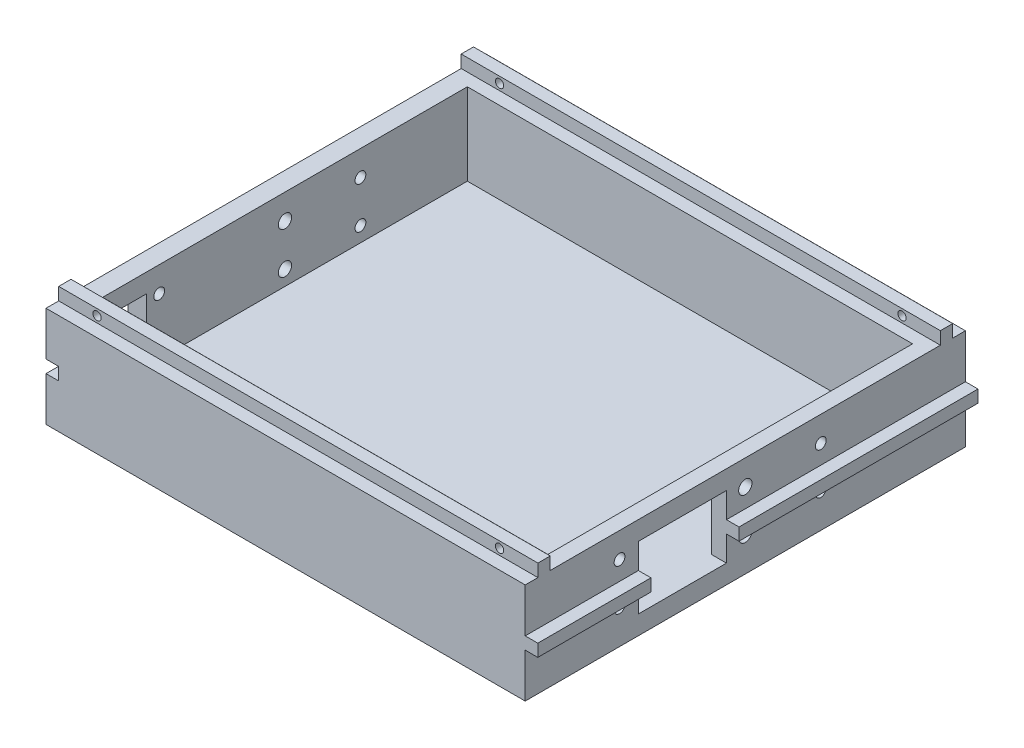
from build123d import *

# Parameters (mm, degrees)
SKETCH1_W           = 190.5
SKETCH1_H           = 175
BOSS_EXTRUDE1_DEPTH = 40
SHELL1_T            = -15
SKETCH2_W           = 175
SKETCH2_H           = 4.9
BOSS_EXTRUDE2_DEPTH = 5
SKETCH3_W           = 5
SKETCH3_H           = 5
CUT_EXTRUDE1_DEPTH  = 175
SKETCH4_W           = 7.5
SKETCH4_H           = 145
CUT_EXTRUDE2_DEPTH  = 25
CUT_EXTRUDE3_START  = -190.5
SKETCH5_R           = 2.65
SKETCH5_R_2         = 2.15
CUT_EXTRUDE3_DEPTH  = 190.5
SKETCH6_W           = 168
SKETCH6_H           = 145
CUT_EXTRUDE4_DEPTH  = 7.5
CUT_EXTRUDE5_REACH  = 140.947
SKETCH7_W           = 9
SKETCH7_H           = 144.996152815
BOSS_EXTRUDE3_START = -7.5
SKETCH9_W           = 190.5
SKETCH9_H           = 5
BOSS_EXTRUDE3_DEPTH = 2.45
SKETCH11_R          = 1.65
CUT_EXTRUDE7_DEPTH  = 4.9
SKETCH12_W          = 35
SKETCH12_H          = 25
CUT_EXTRUDE8_DEPTH  = 213.19154083
CUT_EXTRUDE9_REACH  = 214.192
SKETCH13_W          = 15
SKETCH13_H          = 25


with BuildPart() as part:
    # Sketch1 → Boss-Extrude1 (new body)
    with BuildSketch(Plane(origin=(0, 0, 0), x_dir=(1, 0, 0), z_dir=(0, 1, 0))):
        Rectangle(SKETCH1_W, SKETCH1_H)
    extrude(amount=BOSS_EXTRUDE1_DEPTH)

    # Shell1
    shell1_openings = [part.faces().sort_by_distance(p)[0] for p in [
        (0, 40, 0),
    ]]
    offset(amount=SHELL1_T, openings=shell1_openings, kind=Kind.INTERSECTION)

    # Sketch2 → Boss-Extrude2 (add)
    with BuildSketch(Plane(origin=(95.25, 0, 0), x_dir=(0, 0, -1), z_dir=(1, 0, 0))):
        with Locations((0, 20)):
            Rectangle(SKETCH2_W, SKETCH2_H)
    extrude(amount=BOSS_EXTRUDE2_DEPTH)

    # Sketch3 → Cut-Extrude1 (cut)
    with BuildSketch(Plane.XY.offset(87.5)):
        with Locations((-92.75, 20)):
            Rectangle(SKETCH3_W, SKETCH3_H)
    extrude(amount=-CUT_EXTRUDE1_DEPTH, mode=Mode.SUBTRACT)

    # Sketch4 → Cut-Extrude2 (cut)
    with BuildSketch(Plane(origin=(0, 40, 0), x_dir=(1, 0, 0), z_dir=(0, 1, 0))):
        with Locations((-84, 0)):
            Rectangle(SKETCH4_W, SKETCH4_H)
    extrude(amount=-CUT_EXTRUDE2_DEPTH, mode=Mode.SUBTRACT)

    # Sketch5 → Cut-Extrude3 (cut)
    with BuildSketch(Plane.ZY.offset(95.25).offset(CUT_EXTRUDE3_START)):
        with Locations((0, 30)):
            Circle(SKETCH5_R)
        with Locations((-30, 30)):
            Circle(SKETCH5_R_2)
        with Locations((50, 30)):
            Circle(SKETCH5_R_2)
        with Locations((-30, 13.5)):
            Circle(SKETCH5_R_2)
        with Locations((0, 13.5)):
            Circle(SKETCH5_R)
        with Locations((50, 13.5)):
            Circle(SKETCH5_R_2)
    cut_extrude3 = extrude(amount=CUT_EXTRUDE3_DEPTH, mode=Mode.SUBTRACT)

    # Sketch6 → Cut-Extrude4 (cut)
    with BuildSketch(Plane(origin=(0, 15, 0), x_dir=(1, 0, 0), z_dir=(0, 1, 0))):
        with Locations((-3.75, 0)):
            Rectangle(SKETCH6_W, SKETCH6_H)
    extrude(amount=-CUT_EXTRUDE4_DEPTH, mode=Mode.SUBTRACT)

    # Mirror1: Cut-Extrude3 across plane
    add(cut_extrude3.mirror(Plane(origin=(0, 0, 0), x_dir=(0, 0, 1), z_dir=(1, 0, 0))), mode=Mode.SUBTRACT)

    # Cut-Extrude5: up to this face of the body (flat: up to its plane)
    cut_extrude5_end = Plane(part.part.faces().sort_by_distance((-3.75, 7.5, 0))[0])
    # Sketch7 → Cut-Extrude5 (cut, up to the picked face)
    with BuildSketch(Plane(origin=(0, 40, 0), x_dir=(1, 0, 0), z_dir=(0, 1, 0)), mode=Mode.PRIVATE) as cut_extrude5_sk1:
        with Locations((84.75, 0.001923592)):
            Rectangle(SKETCH7_W, SKETCH7_H)
    cut_extrude5_tool1 = split(extrude(cut_extrude5_sk1.sketch, amount=-CUT_EXTRUDE5_REACH, mode=Mode.PRIVATE), bisect_by=cut_extrude5_end, keep=Keep.BOTH, mode=Mode.PRIVATE)
    add(cut_extrude5_tool1.solids().sort_by(Axis((84.75, 40, -0.001924), (0, -1, 0)))[0], mode=Mode.SUBTRACT)

    # Sketch9 → Boss-Extrude3 (add, symmetric)
    with BuildSketch(Plane.XY.offset(87.5).offset(BOSS_EXTRUDE3_START)):
        with Locations((0, 42.5)):
            Rectangle(SKETCH9_W, SKETCH9_H)
    boss_extrude3 = extrude(amount=BOSS_EXTRUDE3_DEPTH, both=True)

    # Sketch11 → Cut-Extrude7 (cut)
    with BuildSketch(Plane(origin=(0, 0, 77.55), x_dir=(-1, 0, 0), z_dir=(0, 0, -1))):
        with Locations((-80, 42.5)):
            Circle(SKETCH11_R)
        with Locations((80, 42.5)):
            Circle(SKETCH11_R)
    cut_extrude7 = extrude(amount=-CUT_EXTRUDE7_DEPTH, mode=Mode.SUBTRACT)

    # Mirror2: Boss-Extrude3, Cut-Extrude7 across plane
    add(boss_extrude3.mirror(Plane.XY))
    add(cut_extrude7.mirror(Plane.XY), mode=Mode.SUBTRACT)

    # Sketch12 → Cut-Extrude8 (cut, through all)
    with BuildSketch(Plane(origin=(-87.75, 0, 0), x_dir=(0, 0, -1), z_dir=(1, 0, 0))):
        with Locations((-25, 20)):
            Rectangle(SKETCH12_W, SKETCH12_H)
    extrude(amount=CUT_EXTRUDE8_DEPTH, mode=Mode.SUBTRACT)

    # Cut-Extrude9: up to this face of the body (flat: up to its plane)
    cut_extrude9_end = Plane(part.part.faces().sort_by_distance((-95.25, 8.669388557, -0.096447103))[0])
    # Sketch13 → Cut-Extrude9 (cut, up to the picked face)
    with BuildSketch(Plane(origin=(-87.75, 0, 0), x_dir=(0, 0, -1), z_dir=(1, 0, 0)), mode=Mode.PRIVATE) as cut_extrude9_sk1:
        with Locations((-62.5, 20)):
            Rectangle(SKETCH13_W, SKETCH13_H)
    cut_extrude9_tool1 = split(extrude(cut_extrude9_sk1.sketch, amount=-CUT_EXTRUDE9_REACH, mode=Mode.PRIVATE), bisect_by=cut_extrude9_end, keep=Keep.BOTH, mode=Mode.PRIVATE)
    add(cut_extrude9_tool1.solids().sort_by(Axis((-87.75, 20, 62.5), (-1, 0, 0)))[0], mode=Mode.SUBTRACT)


solid = part.part
